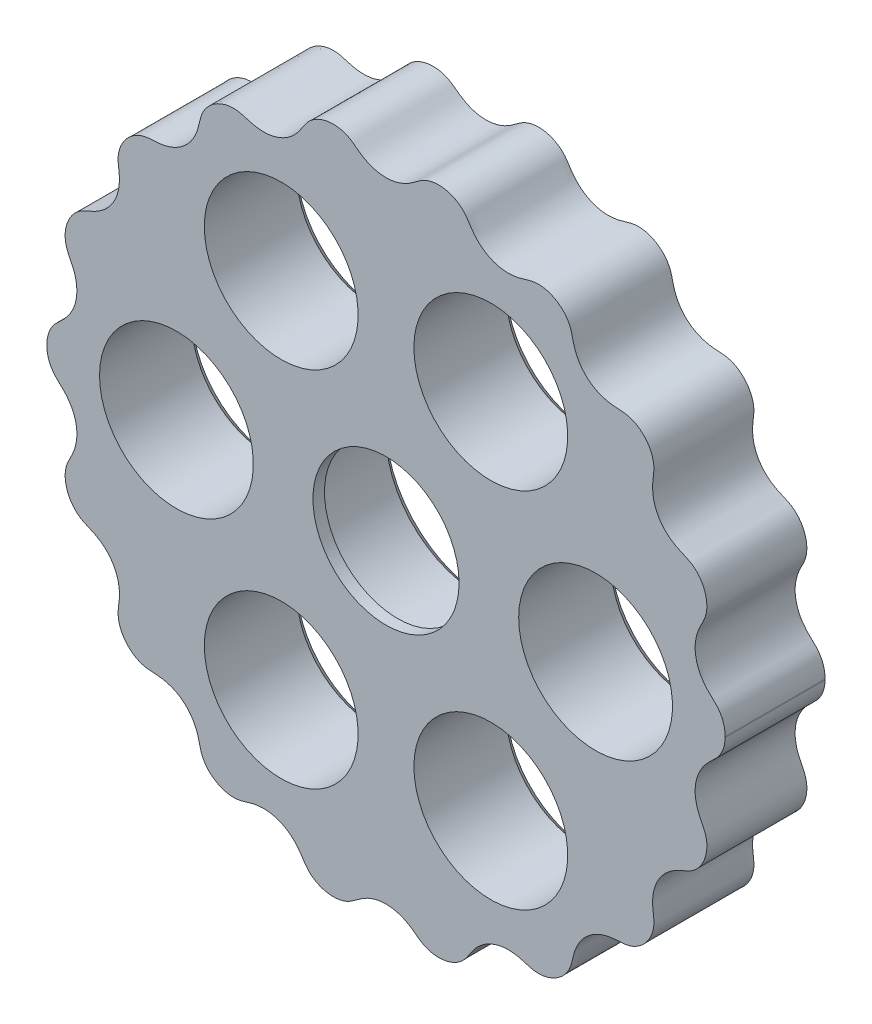
from build123d import *

# Parameters (mm, degrees)
SKETCH1_R           = 12
SKETCH1_R_2         = 10
BOSS_EXTRUDE1_DEPTH = 6.5
SKETCH2_R           = 12
SKETCH2_R_2         = 9.5
BOSS_EXTRUDE2_DEPTH = 1.5
CHAMFER1_SIZE       = 1


with BuildPart() as part:
    # Sketch1 → Boss-Extrude1 (new, symmetric)
    with BuildSketch(Plane.XY):
        with BuildLine():
            ThreePointArc((44.09846271, -0.120297451), (44.099615662, -0.060153637), (44.1, 0))
            add(Edge.make_bspline(
                [(44.1, 0), (44.1, 0.030582339), (44.099295019, 0.091713893), (44.096122609, 0.200230672), (44.087661895, 0.351561907), (44.071795075, 0.531247538), (44.04428375, 0.737073875), (44.006168898, 0.946542296), (43.957425433, 1.152666606), (43.900160222, 1.356431088), (43.812413105, 1.624775233), (43.675936475, 1.956123143), (43.470419463, 2.338777717), (43.197305058, 2.726793245), (42.902812043, 3.059105231), (42.58109647, 3.364199676), (42.254286202, 3.663345295), (41.856986683, 4.049625315), (41.447165826, 4.508756731), (41.051613906, 5.058485168), (40.618789304, 5.8583092), (40.269370645, 6.862026242), (40.137936345, 7.936917522), (40.240404209, 9.024104515), (40.482362435, 9.923761865), (40.724081469, 10.530300762), (40.97108831, 11.03289389), (41.229985791, 11.530543105), (41.474185326, 12.036906231), (41.691183802, 12.750565551), (41.764276023, 13.675936067), (41.623108512, 14.669544933), (41.234478952, 15.674127331), (40.678560364, 16.49565824), (40.090429028, 17.054351983), (39.552857002, 17.402836946), (39.128703091, 17.610539233), (38.781243017, 17.758160085), (38.345889239, 17.940123187), (37.689613694, 18.24208321), (36.853687075, 18.748045274), (35.965131924, 19.564248082), (35.225251456, 20.675396629), (34.804195973, 21.821798409), (34.658229928, 22.799492322), (34.655067852, 23.583725188), (34.701383157, 24.164920169), (34.758800744, 24.627621645), (34.818985589, 25.089923924), (34.84654015, 25.556170296), (34.818210152, 26.051946465), (34.722129932, 26.569072381), (34.505471113, 27.236301), (34.093967839, 28.010306986), (33.438898847, 28.796698359), (32.645298863, 29.376516626), (31.923687064, 29.700988923), (31.339668016, 29.85405597), (30.924684726, 29.917395871), (30.506301072, 29.945434514), (30.087663992, 29.963336051), (29.564799536, 29.997692993), (28.796136326, 30.096152538), (27.801145464, 30.364178651), (26.640226081, 30.964090634), (25.550143195, 31.954774727), (24.846621637, 33.053634631), (24.484382074, 34.021873538), (24.302699129, 34.749289614), (24.179926951, 35.300233441), (24.044423239, 35.849160709), (23.755805702, 36.54188671), (23.218171353, 37.305490718), (22.472071564, 37.98102807), (21.530439008, 38.5042834), (20.580299093, 38.779559581), (19.775815905, 38.833958978), (19.143182873, 38.760677392), (18.686610408, 38.650931511), (18.327313652, 38.542351942), (17.879640212, 38.402209028), (17.187886479, 38.209773042), (16.229461955, 38.054112071), (15.151073467, 38.09274439), (14.100089047, 38.356760976), (13.249031791, 38.739481125), (12.58434133, 39.158952743), (11.977677899, 39.67058215), (11.507578421, 40.1878044), (11.147724423, 40.672318816), (10.867598216, 41.097121697), (10.649089492, 41.440503163), (10.419531368, 41.77693594), (10.161637013, 42.09275822), (9.845224686, 42.408095955), (9.464094596, 42.709555526), (8.895457144, 43.056523218), (8.102126661, 43.373081146), (7.113647762, 43.551480417), (6.146992441, 43.490593114), (5.388787353, 43.281048452), (4.844298116, 43.02834904), (4.486128135, 42.814118135), (4.148316042, 42.569760821), (3.818107922, 42.315822042), (3.398954317, 42.006493157), (2.752963623, 41.586469498), (1.827013196, 41.147371788), (0.58682155, 40.856094169), (-0.825787213, 40.887809229), (-2.036911335, 41.226823143), (-2.922873312, 41.684787727), (-3.539086254, 42.106624435), (-3.938540017, 42.408260791), (-4.256782232, 42.651177885), (-4.586796747, 42.87862351), (-4.936564549, 43.074901023), (-5.473336654, 43.308552029), (-6.222362675, 43.500247903), (-7.156533426, 43.545260842), (-8.230808252, 43.344225225), (-9.141871481, 42.946112946), (-9.791949362, 42.477423805), (-10.230395156, 42.020653292), (-10.510662525, 41.647247429), (-10.715971773, 41.33556996), (-10.967061982, 40.942561621), (-11.368251004, 40.35233862), (-11.993282087, 39.617304076), (-12.97841885, 38.834516845), (-14.307237735, 38.242707883), (-15.622024308, 38.038627126), (-16.707839022, 38.119003307), (-17.500072709, 38.29427816), (-18.018301211, 38.444648049), (-18.429570271, 38.574994209), (-18.844473775, 38.694776108), (-19.268903788, 38.777332232), (-19.729598835, 38.815759727), (-20.221696228, 38.798965837), (-20.874245198, 38.696869462), (-21.66509694, 38.435025616), (-22.514847785, 37.953180038), (-23.200395547, 37.313874079), (-23.640684766, 36.700114689), (-23.897877079, 36.188908416), (-24.038798915, 35.822819516), (-24.14570416, 35.445592878), (-24.232416955, 35.063700515), (-24.340954715, 34.586246717), (-24.543215208, 33.839940537), (-24.947788797, 32.85750226), (-25.739597296, 31.72684512), (-26.819760535, 30.854338716), (-27.905465707, 30.341227289), (-28.868094308, 30.088202548), (-29.541958638, 29.996548127), (-30.108462772, 29.962476373), (-30.655020829, 29.938205731), (-31.201309824, 29.891812603), (-31.908031001, 29.72087577), (-32.723642871, 29.32967324), (-33.436966401, 28.77384955), (-34.02171822, 28.089347477), (-34.431915089, 27.387499691), (-34.694662263, 26.709230746), (-34.818436356, 26.099785622), (-34.844847688, 25.585996453), (-34.822940355, 25.179082946), (-34.791436358, 24.879005031), (-34.753038768, 24.579920299), (-34.716428646, 24.280538869), (-34.679148344, 23.905353418), (-34.654740012, 23.453338115), (-34.664444249, 22.924831089), (-34.75195722, 22.174555486), (-34.992777688, 21.246926527), (-35.49485932, 20.195629167), (-36.284987253, 19.233585586), (-37.112912437, 18.585709781), (-37.816422634, 18.186921293), (-38.333673471, 17.945504004), (-38.754550748, 17.769073044), (-39.175364364, 17.592154086), (-39.582378236, 17.383802375), (-39.986628463, 17.114698723), (-40.376004542, 16.779360681), (-40.834106283, 16.270323824), (-41.287004812, 15.551399504), (-41.637308827, 14.62812173), (-41.768371507, 13.595709672), (-41.684124506, 12.748436455), (-41.492248568, 12.108422891), (-41.295290007, 11.662675119), (-41.118291125, 11.315642771), (-40.894871832, 10.883113444), (-40.649341587, 10.358340876), (-40.418642377, 9.726303868), (-40.204358561, 8.795196487), (-40.145522417, 7.652328205), (-40.381120536, 6.331595163), (-40.965450241, 5.118884037), (-41.61712394, 4.290668733), (-42.161541191, 3.750146723), (-42.518756844, 3.420807878), (-42.802947684, 3.155593434), (-43.138835002, 2.803881527), (-43.535605258, 2.268096445), (-43.901990606, 1.501593586), (-44.130059664, 0.487327288), (-44.115280857, -0.499721202), (-43.934198242, -1.330483893), (-43.676038829, -1.966299666), (-43.423261334, -2.41490416), (-43.133783943, -2.806056266), (-42.821060018, -3.14086823), (-42.485157644, -3.451315525), (-42.149556174, -3.761932294), (-41.745906585, -4.167166853), (-41.221590771, -4.785017037), (-40.666695402, -5.680506796), (-40.257051826, -6.857452706), (-40.149173837, -8.017879378), (-40.243521673, -8.970889449), (-40.419776292, -9.70358782), (-40.592342067, -10.201915648), (-40.770344358, -10.616974673), (-40.933805627, -10.955757023), (-41.070477482, -11.223839478), (-41.208433622, -11.491182997), (-41.339912596, -11.761991738), (-41.498308259, -12.136437903), (-41.647421101, -12.627604975), (-41.737865857, -13.24140742), (-41.721603482, -13.966977122), (-41.573841835, -14.773142625), (-41.250138826, -15.629701143), (-40.749252092, -16.415207139), (-40.147205961, -17.010252187), (-39.594819817, -17.379378074), (-39.161311144, -17.596176795), (-38.805025373, -17.748345217), (-38.358110501, -17.934647133), (-37.663212048, -18.253297543), (-36.76838824, -18.802562479), (-35.939362408, -19.601736571), (-35.316158697, -20.558954833), (-34.950122541, -21.436055872), (-34.754042331, -22.173538439), (-34.656088924, -22.935545613), (-34.653931862, -23.61067391), (-34.703719863, -24.189996698), (-34.765383694, -24.674575683), (-34.81397009, -25.062408262), (-34.841540871, -25.452665597), (-34.833181142, -25.844048896), (-34.764965034, -26.410975943), (-34.55998969, -27.136274054), (-34.130106215, -27.97665388), (-33.486600338, -28.726292496), (-32.817113708, -29.248044889), (-32.215634741, -29.570550395), (-31.737327038, -29.753738779), (-31.267500658, -29.870036943), (-30.815471687, -29.928441969), (-30.361030791, -29.951506086), (-29.906667319, -29.972758144), (-29.339776297, -30.021083845), (-28.544466187, -30.151723632), (-27.546704683, -30.471434918), (-26.478173427, -31.095048646), (-25.647320317, -31.898584035), (-25.10239482, -32.674476355), (-24.761365603, -33.336069955), (-24.568767068, -33.819988104), (-24.43437926, -34.245337494), (-24.339301092, -34.604486443), (-24.270753084, -34.893678816), (-24.205608209, -35.183590943), (-24.136880384, -35.472757033), (-24.050811004, -35.77755897), (-23.936799286, -36.09387039), (-23.748054056, -36.501876609), (-23.449424294, -36.980019677), (-23.022208126, -37.481293945), (-22.37190494, -38.029035732), (-21.543996884, -38.495425322), (-20.716802817, -38.750694736), (-19.945512169, -38.825169103), (-19.360009153, -38.787513155), (-18.963533832, -38.721380529), (-18.575040389, -38.619360483), (-18.192152994, -38.499434578), (-17.712447107, -38.352692809), (-16.987140235, -38.168064143), (-15.995396696, -38.043289356), (-14.740360378, -38.14351655), (-13.403770201, -38.60204859), (-12.341500387, -39.303110651), (-11.625334349, -40.033023765), (-11.164189776, -40.648291672), (-10.877480388, -41.081769904), (-10.654112339, -41.432376754), (-10.362293943, -41.862579814), (-9.898957469, -42.39380659), (-9.186877311, -42.932069056), (-8.203652248, -43.360186881), (-7.073425779, -43.552918299), (-6.114758961, -43.484141936), (-5.371303854, -43.274035793), (-4.83794451, -43.024530718), (-4.487448407, -42.814603777), (-4.156442995, -42.575830484), (-3.833097062, -42.327331889), (-3.423271009, -42.023841625), (-2.753716617, -41.584000957), (-1.761177835, -41.114046368), (-0.442541783, -40.830777832), (1.04034648, -40.920254359), (2.252417482, -41.317610326), (3.09650233, -41.792742644), (3.678670512, -42.210207914), (4.050490435, -42.494481264), (4.35060621, -42.718566731), (4.741935769, -42.976220074), (5.310916554, -43.259191601), (6.084178406, -43.480922288), (7.077933685, -43.546124783), (8.156476131, -43.370102225), (9.018462764, -43.011157465), (9.656016991, -42.578729122), (10.080782748, -42.178919727), (10.342853812, -41.877186594), (10.575683914, -41.552671326), (10.791284769, -41.216992947), (11.061971873, -40.798077323), (11.493264018, -40.191749402), (12.163295218, -39.457960445), (13.179415143, -38.7205455), (14.492583144, -38.199444452), (15.758641774, -38.041292413), (16.782918125, -38.132591437), (17.536861339, -38.304275448), (18.038653926, -38.451113119), (18.437255387, -38.577263602), (18.839333512, -38.692964935), (19.250287676, -38.774080539), (19.706760182, -38.815154541), (20.204477302, -38.801337083), (20.87838832, -38.698153021), (21.705590007, -38.420535352), (22.463704881, -37.977676038), (23.114687414, -37.389734315), (23.546273059, -36.834785401), (23.812890959, -36.3801295), (24.008221759, -35.922420332), (24.140860623, -35.473592642), (24.242260888, -35.017553876), (24.347195828, -34.56224792), (24.50376963, -33.999345112), (24.777370507, -33.262603258), (25.252616649, -32.39340942), (26.044466378, -31.462244735), (27.12250307, -30.675469892), (28.236854798, -30.216832645), (29.193640074, -30.030337342), (29.912043171, -29.972421383), (30.382335346, -29.950597318), (30.75847886, -29.930367614), (31.226932083, -29.879153412), (31.849447973, -29.734048413), (32.590755945, -29.409273353), (33.392350293, -28.826733082), (34.100018355, -28.014638248), (34.571598965, -27.127481886), (34.817960044, -26.23031971), (34.855943096, -25.483616367), (34.798003056, -24.923242604), (34.725020225, -24.365642928), (34.645359033, -23.622859719), (34.649919195, -22.592823235), (34.924428859, -21.334088241), (35.584058713, -20.049835251), (36.443231319, -19.087381218), (37.268728118, -18.484675749), (37.961490591, -18.114609028), (38.466138814, -17.888697896), (38.874728958, -17.719891835), (39.280230775, -17.542929398), (39.669161606, -17.330705101), (40.056946046, -17.059046934), (40.432076281, -16.722445885), (40.875433593, -16.212475938), (41.322489458, -15.479264938), (41.615933906, -14.664126065), (41.73887756, -13.804953845), (41.716607993, -13.106158322), (41.632371772, -12.588810662), (41.492050776, -12.114232308), (41.309224007, -11.686155096), (41.095874956, -11.273392968), (40.883820488, -10.859972012), (40.640863665, -10.332170587), (40.373573773, -9.597772207), (40.17218546, -8.633470378), (40.168487478, -7.413916715), (40.475763876, -6.114266785), (41.026608021, -5.038111668), (41.638043945, -4.271071158), (42.151964065, -3.759496054), (42.499799474, -3.438109958), (42.777261114, -3.180133336), (43.107305972, -2.839919436), (43.41761136, -2.433194203), (43.652917128, -2.012034456), (43.824244209, -1.593942172), (43.923825344, -1.282354037), (43.98889457, -1.028195172), (44.032990151, -0.803371317), (44.061583152, -0.612612736), (44.079561938, -0.444083336), (44.090428215, -0.304041932), (44.095681807, -0.205349469), (44.097737985, -0.14864679), (44.09846271, -0.120297451)],
                knots=[0.066570873, 0.066570873, 0.066570873, 0.066570873, 0.066570873, 0.066980916, 0.067390959, 0.067801002, 0.068211045, 0.069031131, 0.069851217, 0.07026126, 0.070671303, 0.071491388, 0.07313156, 0.074419241, 0.075706922, 0.076994603, 0.078282284, 0.079569965, 0.080857646, 0.083433008, 0.085425324, 0.08741764, 0.091402271, 0.095714799, 0.097871063, 0.100027327, 0.102201894, 0.103289177, 0.104376461, 0.106551028, 0.108725595, 0.111901818, 0.115078042, 0.11810879, 0.121139538, 0.123333277, 0.124430146, 0.125527015, 0.126623885, 0.127720754, 0.129914493, 0.133920534, 0.137926576, 0.141605194, 0.145283812, 0.147993221, 0.149347925, 0.150702629, 0.152057334, 0.153412038, 0.154766742, 0.156121447, 0.157814915, 0.159508384, 0.162895322, 0.166245109, 0.169594896, 0.170812693, 0.172030489, 0.173248286, 0.174466083, 0.17568388, 0.176901677, 0.17933727, 0.183463281, 0.187589293, 0.191925911, 0.19626253, 0.198450219, 0.199544064, 0.200637908, 0.202825598, 0.205013287, 0.208207964, 0.211402641, 0.214415516, 0.217428391, 0.219609374, 0.220699866, 0.221790357, 0.222880849, 0.22397134, 0.226152324, 0.230133335, 0.234114346, 0.236390692, 0.238667038, 0.240943384, 0.24321973, 0.245585308, 0.246768097, 0.247950887, 0.249133676, 0.250316465, 0.251499254, 0.252682043, 0.254316498, 0.255950954, 0.259219864, 0.26255088, 0.265881896, 0.267092585, 0.268303275, 0.269513964, 0.270724654, 0.271935343, 0.273146033, 0.275567412, 0.279671716, 0.28377602, 0.287796029, 0.291816039, 0.294143003, 0.295306485, 0.296469967, 0.297633449, 0.298796931, 0.299960413, 0.301123895, 0.304425603, 0.307727312, 0.310722301, 0.313717291, 0.315885698, 0.316969902, 0.318054105, 0.319138309, 0.320222512, 0.322390919, 0.326346802, 0.330302685, 0.334706574, 0.339110463, 0.341618419, 0.342872397, 0.344126375, 0.345380353, 0.346634331, 0.347888309, 0.349142287, 0.35074281, 0.352343333, 0.355544379, 0.358770032, 0.361995685, 0.363133751, 0.364271816, 0.365409882, 0.366547948, 0.367686013, 0.368824079, 0.37110021, 0.375531317, 0.379962424, 0.384669464, 0.387022985, 0.389376505, 0.391497023, 0.392557282, 0.393617541, 0.39573806, 0.397858578, 0.400955073, 0.404051568, 0.406155954, 0.40826034, 0.410364726, 0.412469112, 0.413345475, 0.414221839, 0.415098202, 0.415974566, 0.41685093, 0.417727293, 0.41948002, 0.421232748, 0.422985475, 0.426490929, 0.430570083, 0.434649237, 0.437301685, 0.438627909, 0.439954133, 0.441280356, 0.44260658, 0.443932804, 0.445259028, 0.446911395, 0.448563762, 0.451868496, 0.455075717, 0.458282939, 0.460546531, 0.461678327, 0.462810123, 0.463941918, 0.465073714, 0.467337306, 0.469540092, 0.471742878, 0.47614845, 0.480544266, 0.484940083, 0.487198922, 0.488328342, 0.489457762, 0.490587182, 0.491716602, 0.493975441, 0.497175621, 0.5003758, 0.503687282, 0.505343023, 0.506998763, 0.50832765, 0.509656537, 0.510985424, 0.51231431, 0.513643197, 0.514972084, 0.517629857, 0.521717381, 0.525804906, 0.529302233, 0.531050896, 0.53279956, 0.534548223, 0.535422555, 0.536296887, 0.537171218, 0.53804555, 0.538919882, 0.539794214, 0.541893842, 0.543993471, 0.5460931, 0.548192729, 0.551381438, 0.554570148, 0.556821293, 0.557946865, 0.559072438, 0.560198011, 0.561323583, 0.563574729, 0.567954651, 0.572334572, 0.57454527, 0.576755967, 0.578966665, 0.581177362, 0.583448707, 0.58458438, 0.585720053, 0.586855726, 0.587991398, 0.589127071, 0.590262744, 0.593481387, 0.59670003, 0.599993743, 0.601640599, 0.603287456, 0.604609357, 0.605931259, 0.60725316, 0.608575062, 0.609896963, 0.611218864, 0.613862667, 0.617928144, 0.62199362, 0.62544775, 0.627174814, 0.628901879, 0.630628943, 0.631492476, 0.632356008, 0.63321954, 0.634083073, 0.634946605, 0.635810137, 0.636898505, 0.637986872, 0.640163606, 0.64234034, 0.644517075, 0.647825992, 0.651134909, 0.65230094, 0.653466972, 0.654633004, 0.655799036, 0.656965067, 0.658131099, 0.660463162, 0.664492037, 0.668520911, 0.672616957, 0.676713003, 0.679128965, 0.680336947, 0.681544928, 0.68275291, 0.683960891, 0.686376854, 0.68970069, 0.693024526, 0.696300307, 0.699576088, 0.700761305, 0.701946522, 0.703131739, 0.704316956, 0.705502173, 0.70668739, 0.709057825, 0.713619923, 0.718182022, 0.722153474, 0.726124927, 0.728301098, 0.729389184, 0.73047727, 0.731565356, 0.732653441, 0.734829613, 0.737835677, 0.740841741, 0.744131712, 0.747421683, 0.748581038, 0.749740394, 0.75089975, 0.752059105, 0.753218461, 0.754377817, 0.756696528, 0.7607021, 0.764707672, 0.768825411, 0.77294315, 0.775373332, 0.776588423, 0.777803513, 0.779018604, 0.780233695, 0.781448785, 0.782663876, 0.784335202, 0.786006528, 0.78934918, 0.792743127, 0.794440101, 0.796137075, 0.797494633, 0.798852192, 0.80020975, 0.801567309, 0.802924867, 0.804282426, 0.806997543, 0.810683815, 0.814370087, 0.818366607, 0.822363127, 0.824551987, 0.825646417, 0.826740847, 0.827835278, 0.828929708, 0.831118568, 0.834142511, 0.837166454, 0.84034971, 0.843532966, 0.845712512, 0.847892057, 0.84898183, 0.850071603, 0.852251149, 0.856572869, 0.860894589, 0.864871123, 0.868847657, 0.871417421, 0.872702303, 0.873987185, 0.875272067, 0.876556949, 0.877841831, 0.879126713, 0.880763442, 0.882400171, 0.885673629, 0.889049125, 0.890736874, 0.892424622, 0.893774692, 0.895124762, 0.896474832, 0.897824901, 0.899174971, 0.900525041, 0.90322518, 0.906891318, 0.910557455, 0.914578945, 0.918600435, 0.920802146, 0.921903002, 0.923003857, 0.924104713, 0.925205569, 0.92740728, 0.92892819, 0.929688644, 0.930449099, 0.931209554, 0.931970009, 0.932350236, 0.932730464, 0.933110691, 0.933490919, 0.933490919, 0.933490919, 0.933490919, 0.933490919], degree=4))
        make_face()
        with Locations(Location((0, 0, 0), (0, 0, 180))):
            Circle(SKETCH1_R, mode=Mode.SUBTRACT)
        with Locations(Location((27.25, 0, 0), (0, 0, 180))):
            Circle(SKETCH1_R_2, mode=Mode.SUBTRACT)
        with Locations(Location((13.625, -23.599192253, 0), (0, 0, 180))):
            Circle(SKETCH1_R_2, mode=Mode.SUBTRACT)
        with Locations(Location((-13.625, -23.599192253, 0), (0, 0, 180))):
            Circle(SKETCH1_R_2, mode=Mode.SUBTRACT)
        with Locations(Location((-27.25, 0, 0), (0, 0, 180))):
            Circle(SKETCH1_R_2, mode=Mode.SUBTRACT)
        with Locations(Location((-13.625, 23.599192253, 0), (0, 0, 180))):
            Circle(SKETCH1_R_2, mode=Mode.SUBTRACT)
        with Locations(Location((13.625, 23.599192253, 0), (0, 0, 180))):
            Circle(SKETCH1_R_2, mode=Mode.SUBTRACT)
    extrude(amount=BOSS_EXTRUDE1_DEPTH, both=True)

    # Sketch2 → Boss-Extrude2 (add)
    with BuildSketch(Plane.XY.offset(6.5)):
        with Locations(Location((0, 0, 0), (0, 0, 180))):
            Circle(SKETCH2_R)
        Circle(SKETCH2_R_2, mode=Mode.SUBTRACT)
    extrude(amount=-BOSS_EXTRUDE2_DEPTH)

    # Chamfer1
    chamfer1_edges = [part.edges().sort_by_distance(p)[0] for p in [
        (37.25, 0, -6.5),
        (23.625, -23.599192253, -6.5),
        (-3.625, -23.599192253, -6.5),
        (-17.25, 0, -6.5),
        (-3.625, 23.599192253, -6.5),
        (23.625, 23.599192253, -6.5),
        (12, 0, -6.5),
    ]]
    chamfer(chamfer1_edges, length=CHAMFER1_SIZE)


solid = part.part
